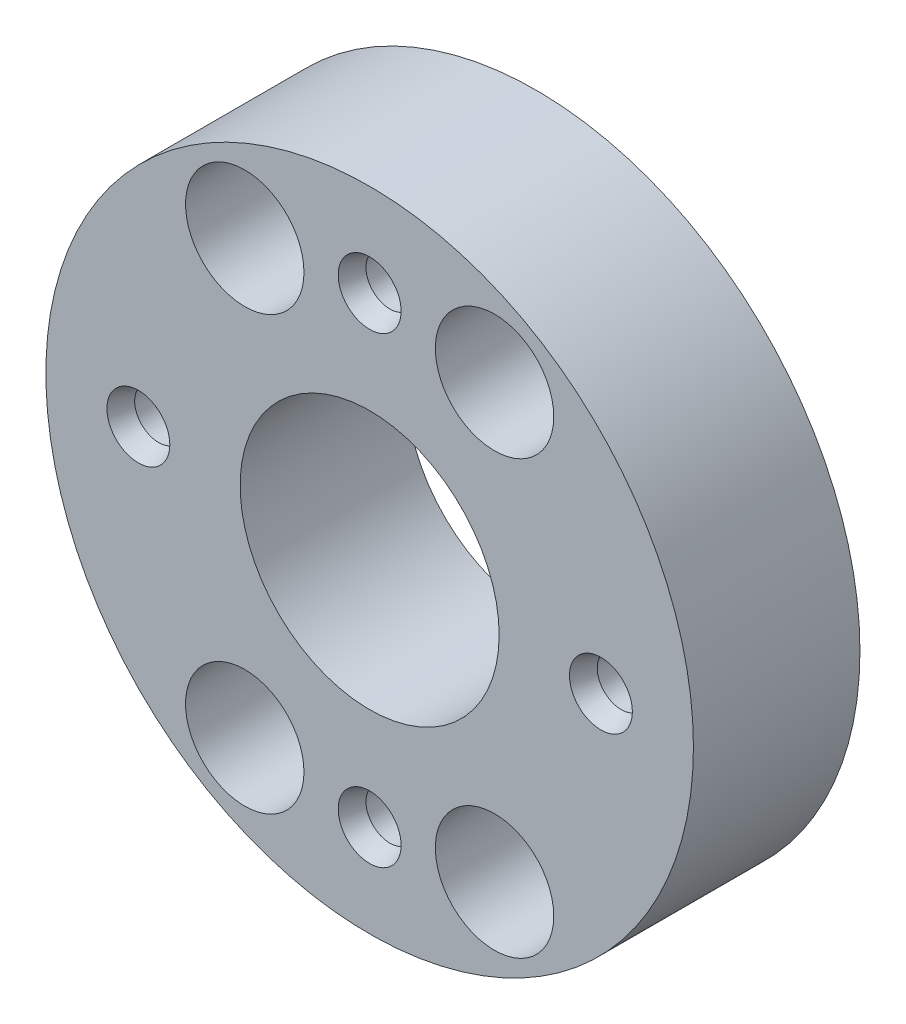
from build123d import *

# Parameters (mm, degrees)
SKETCH_1_R          = 17.5
EXTRUDE_1_DEPTH     = 9
SKETCH_2_R          = 1.3
CUT_EXTRUDE_1_DEPTH = 8
SKETCH_3_R          = 1.65
CUT_EXTRUDE_2_DEPTH = 9
SKETCH_4_R          = 7
CUT_EXTRUDE_3_DEPTH = 9
CHAMFER_1_SIZE      = 0.4
CHAMFER_1_SIZE2     = 1.098990968
SKETCH_5_R          = 3.2
CUT_EXTRUDE_4_DEPTH = 5


with BuildPart() as part:
    # 草图1 → 凸台-拉伸1 (new body)
    with BuildSketch(Plane.XY):
        Circle(SKETCH_1_R)
    extrude(amount=-EXTRUDE_1_DEPTH)

    # 草图2 → 切除-拉伸1 (cut)
    with BuildSketch(Plane.XY):
        with Locations((12.5, 0)):
            Circle(SKETCH_2_R)
        with Locations((0, -12.5)):
            Circle(SKETCH_2_R)
        with Locations((-12.5, 0)):
            Circle(SKETCH_2_R)
        with Locations((0, 12.5)):
            Circle(SKETCH_2_R)
    extrude(amount=-CUT_EXTRUDE_1_DEPTH, mode=Mode.SUBTRACT)

    # 草图3 → 切除-拉伸2 (cut)
    with BuildSketch(Plane.XY):
        with Locations((6.75, -11.691342951)):
            Circle(SKETCH_3_R)
        with Locations((-6.75, -11.691342951)):
            Circle(SKETCH_3_R)
        with Locations((-6.75, 11.691342951)):
            Circle(SKETCH_3_R)
        with Locations((6.75, 11.691342951)):
            Circle(SKETCH_3_R)
    extrude(amount=-CUT_EXTRUDE_2_DEPTH, mode=Mode.SUBTRACT)

    # 草图4 → 切除-拉伸3 (cut)
    with BuildSketch(Plane.XY):
        Circle(SKETCH_4_R)
    extrude(amount=-CUT_EXTRUDE_3_DEPTH, mode=Mode.SUBTRACT)

    # 倒角1
    chamfer_1_edges = [part.edges().sort_by_distance(p)[0] for p in [
        (-1.3, -12.5, 0),
        (-13.8, 0, 0),
        (-1.3, 12.5, 0),
        (11.2, 0, 0),
    ]]
    chamfer_1_side = [part.faces().sort_by_distance(p)[0] for p in [
        (-17.005025253, 0, 0),
    ]]
    chamfer(chamfer_1_edges, length=CHAMFER_1_SIZE, length2=CHAMFER_1_SIZE2, reference=chamfer_1_side[0])

    # 草图5 → 切除-拉伸4 (cut)
    with BuildSketch(Plane.XY):
        with Locations((-6.75, 11.691342951)):
            Circle(SKETCH_5_R)
        with Locations((6.75, 11.691342951)):
            Circle(SKETCH_5_R)
        with Locations((6.75, -11.691342951)):
            Circle(SKETCH_5_R)
        with Locations((-6.75, -11.691342951)):
            Circle(SKETCH_5_R)
    extrude(amount=-CUT_EXTRUDE_4_DEPTH, mode=Mode.SUBTRACT)


solid = part.part
